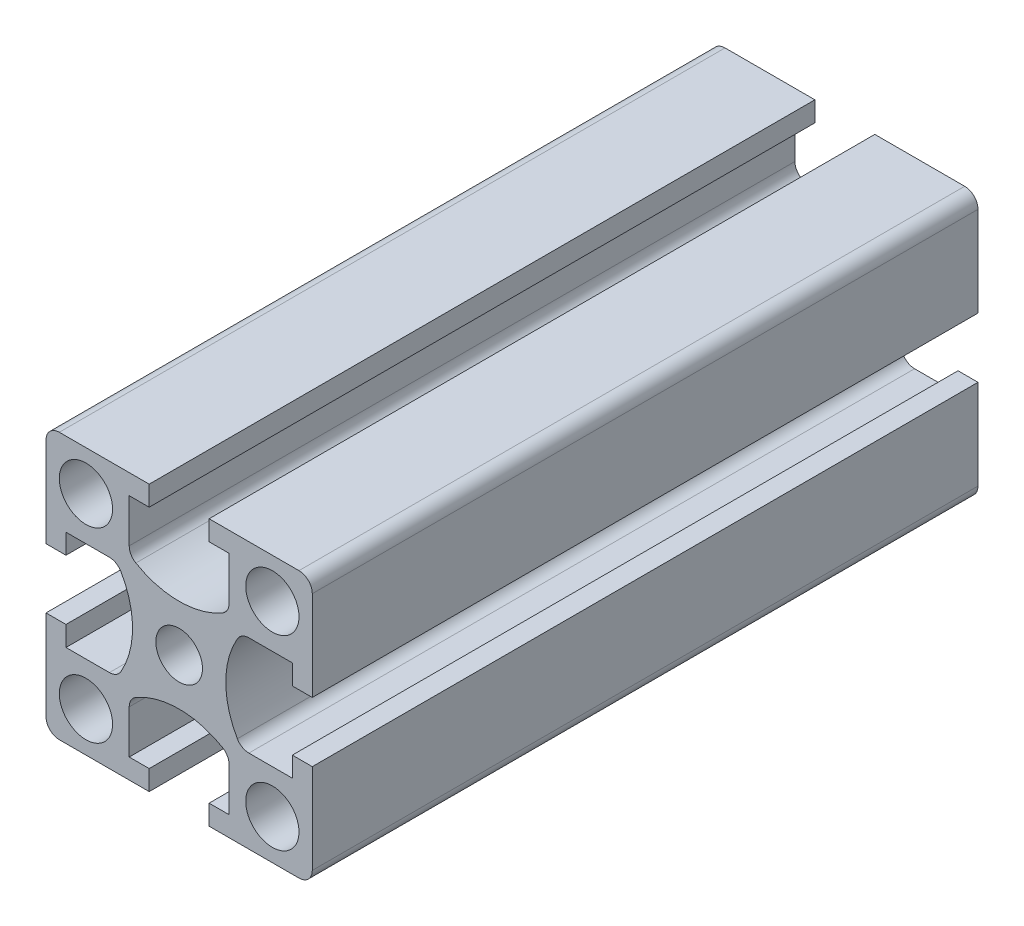
from build123d import *

# Parameters (mm, degrees)
SKETCH1_R           = 4
SKETCH1_R_2         = 3.5
BOSS_EXTRUDE1_DEPTH = 100


with BuildPart() as part:
    # Sketch1 → Boss-Extrude1 (new body)
    with BuildSketch(Plane.XY):
        with BuildLine():
            Line((-20, 18), (-20, 4.5))
            Line((-20, 4.5), (-17, 4.5))
            Line((-17, 4.5), (-17, 7.5))
            Line((-17, 7.5), (-10.473720558, 7.5))
            ThreePointArc((-10.473720558, 7.5), (-9.473720558, 7.232050808), (-8.741669751, 6.5))
            ThreePointArc((-8.741669751, 6.5), (-7, 0), (-8.741669751, -6.5))
            ThreePointArc((-8.741669751, -6.5), (-9.473720558, -7.232050808), (-10.473720558, -7.5))
            Line((-10.473720558, -7.5), (-17, -7.5))
            Line((-17, -7.5), (-17, -4.5))
            Line((-17, -4.5), (-20, -4.5))
            Line((-20, -4.5), (-20, -18))
            ThreePointArc((-20, -18), (-19.414213562, -19.414213562), (-18, -20))
            Line((-18, -20), (-4.5, -20))
            Line((-4.5, -20), (-4.5, -17))
            Line((-4.5, -17), (-7.5, -17))
            Line((-7.5, -17), (-7.5, -10.473720558))
            ThreePointArc((-7.5, -10.473720558), (-7.232050808, -9.473720558), (-6.5, -8.741669751))
            ThreePointArc((-6.5, -8.741669751), (0, -7), (6.5, -8.741669751))
            ThreePointArc((6.5, -8.741669751), (7.232050808, -9.473720558), (7.5, -10.473720558))
            Line((7.5, -10.473720558), (7.5, -17))
            Line((7.5, -17), (4.5, -17))
            Line((4.5, -17), (4.5, -20))
            Line((4.5, -20), (18, -20))
            ThreePointArc((18, -20), (19.414213562, -19.414213562), (20, -18))
            Line((20, -18), (20, -4.5))
            Line((20, -4.5), (17, -4.5))
            Line((17, -4.5), (17, -7.5))
            Line((17, -7.5), (10.473720558, -7.5))
            ThreePointArc((10.473720558, -7.5), (9.473720558, -7.232050808), (8.741669751, -6.5))
            ThreePointArc((8.741669751, -6.5), (7, 0), (8.741669751, 6.5))
            ThreePointArc((8.741669751, 6.5), (9.473720558, 7.232050808), (10.473720558, 7.5))
            Line((10.473720558, 7.5), (17, 7.5))
            Line((17, 7.5), (17, 4.5))
            Line((17, 4.5), (20, 4.5))
            Line((20, 4.5), (20, 18))
            ThreePointArc((20, 18), (19.414213562, 19.414213562), (18, 20))
            Line((18, 20), (4.5, 20))
            Line((4.5, 20), (4.5, 17))
            Line((4.5, 17), (7.5, 17))
            Line((7.5, 17), (7.5, 10.473720558))
            ThreePointArc((7.5, 10.473720558), (7.232050808, 9.473720558), (6.5, 8.741669751))
            ThreePointArc((6.5, 8.741669751), (0, 7), (-6.5, 8.741669751))
            ThreePointArc((-6.5, 8.741669751), (-7.232050808, 9.473720558), (-7.5, 10.473720558))
            Line((-7.5, 10.473720558), (-7.5, 17))
            Line((-7.5, 17), (-4.5, 17))
            Line((-4.5, 17), (-4.5, 20))
            Line((-4.5, 20), (-18, 20))
            ThreePointArc((-18, 20), (-19.414213562, 19.414213562), (-20, 18))
        make_face()
        with Locations((-14, -14)):
            Circle(SKETCH1_R, mode=Mode.SUBTRACT)
        with Locations((14, -14)):
            Circle(SKETCH1_R, mode=Mode.SUBTRACT)
        with Locations((14, 14)):
            Circle(SKETCH1_R, mode=Mode.SUBTRACT)
        Circle(SKETCH1_R_2, mode=Mode.SUBTRACT)
        with Locations((-14, 14)):
            Circle(SKETCH1_R, mode=Mode.SUBTRACT)
    extrude(amount=BOSS_EXTRUDE1_DEPTH)


solid = part.part
